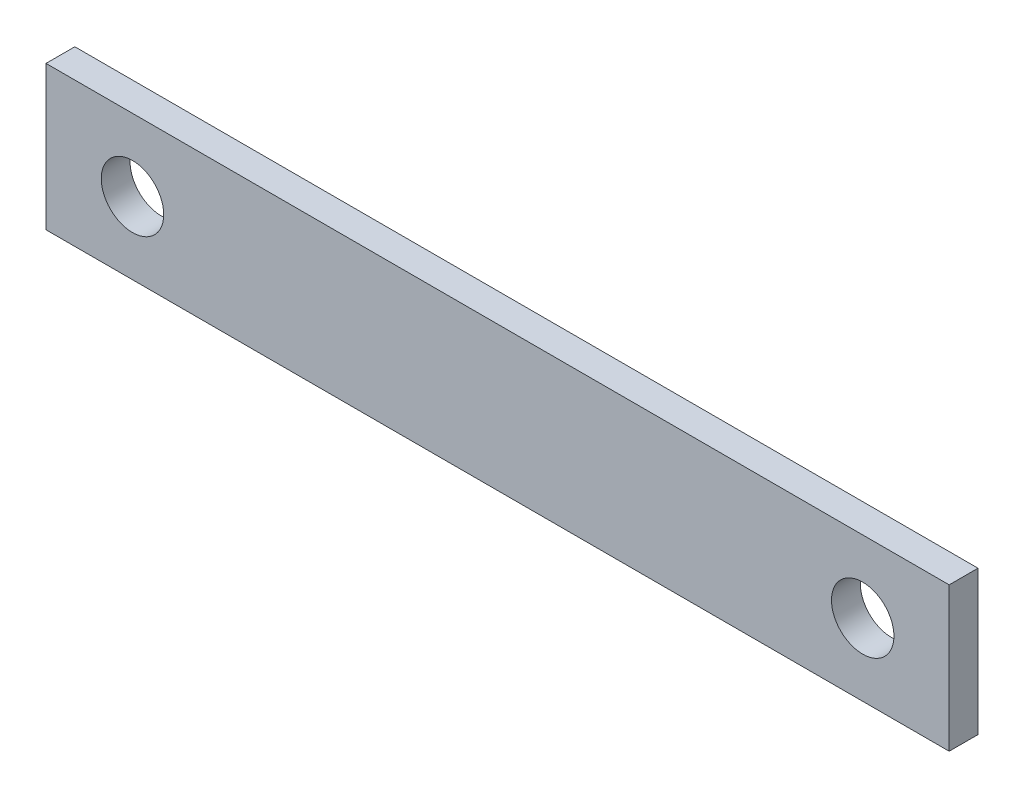
from build123d import *

# Parameters (mm, degrees)
CROQUIS1_W              = 94
CROQUIS1_H              = 15
SALIENTE_EXTRUIR1_DEPTH = 3
CORTAR_EXTRUIR1_REACH   = 49.689
CROQUIS2_R              = 3.25


with BuildPart() as part:
    # Croquis1 → Saliente-Extruir1 (new body)
    with BuildSketch(Plane.XY):
        Rectangle(CROQUIS1_W, CROQUIS1_H)
    extrude(amount=SALIENTE_EXTRUIR1_DEPTH)

    # Croquis2 → Cortar-Extruir1 (cut, up to next)
    with BuildSketch(Plane.XY.offset(3), mode=Mode.PRIVATE) as cortar_extruir1_sk1:
        with Locations((-38, 0)):
            Circle(CROQUIS2_R)
    cortar_extruir1_tool1 = extrude(cortar_extruir1_sk1.sketch, amount=-CORTAR_EXTRUIR1_REACH, mode=Mode.PRIVATE) & part.part
    # Croquis2 → Cortar-Extruir1 (cut, up to next)
    with BuildSketch(Plane.XY.offset(3), mode=Mode.PRIVATE) as cortar_extruir1_sk2:
        with Locations((38, 0)):
            Circle(CROQUIS2_R)
    cortar_extruir1_tool2 = extrude(cortar_extruir1_sk2.sketch, amount=-CORTAR_EXTRUIR1_REACH, mode=Mode.PRIVATE) & part.part
    add(cortar_extruir1_tool1.solids().sort_by_distance((-38, 0, 3))[0], mode=Mode.SUBTRACT)
    add(cortar_extruir1_tool2.solids().sort_by_distance((38, 0, 3))[0], mode=Mode.SUBTRACT)


solid = part.part
